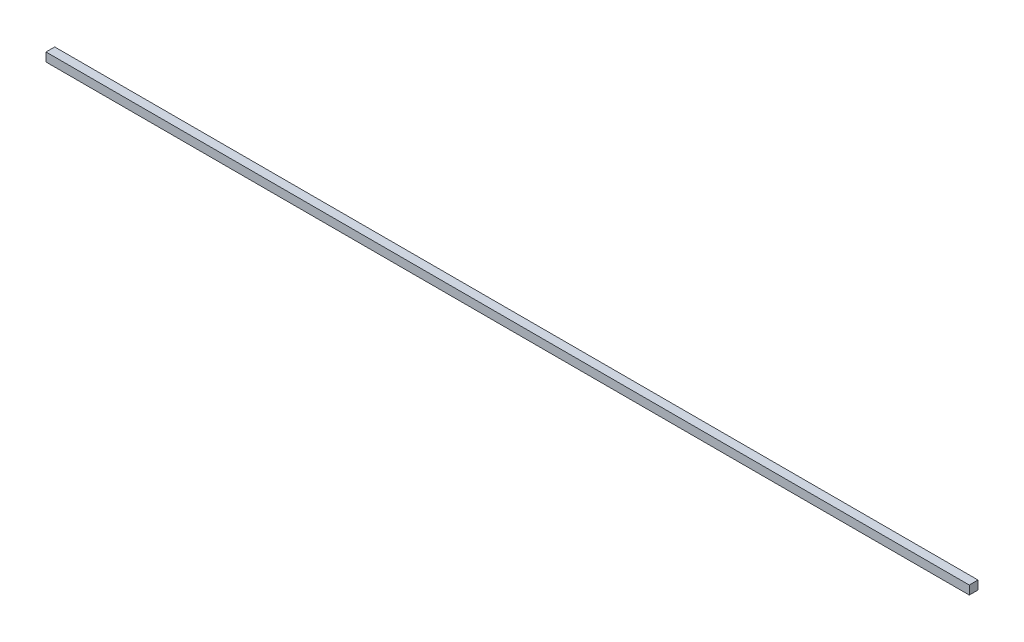
from build123d import *

# Parameters (mm, degrees)
SKETCH1_W           = 673.1
SKETCH1_H           = 6.35
BOSS_EXTRUDE2_DEPTH = 6.35


with BuildPart() as part:
    # Sketch1 → Boss-Extrude2 (new body)
    with BuildSketch(Plane(origin=(0, 0, 0), x_dir=(1, 0, 0), z_dir=(0, 1, 0))):
        Rectangle(SKETCH1_W, SKETCH1_H)
    extrude(amount=BOSS_EXTRUDE2_DEPTH)


solid = part.part
